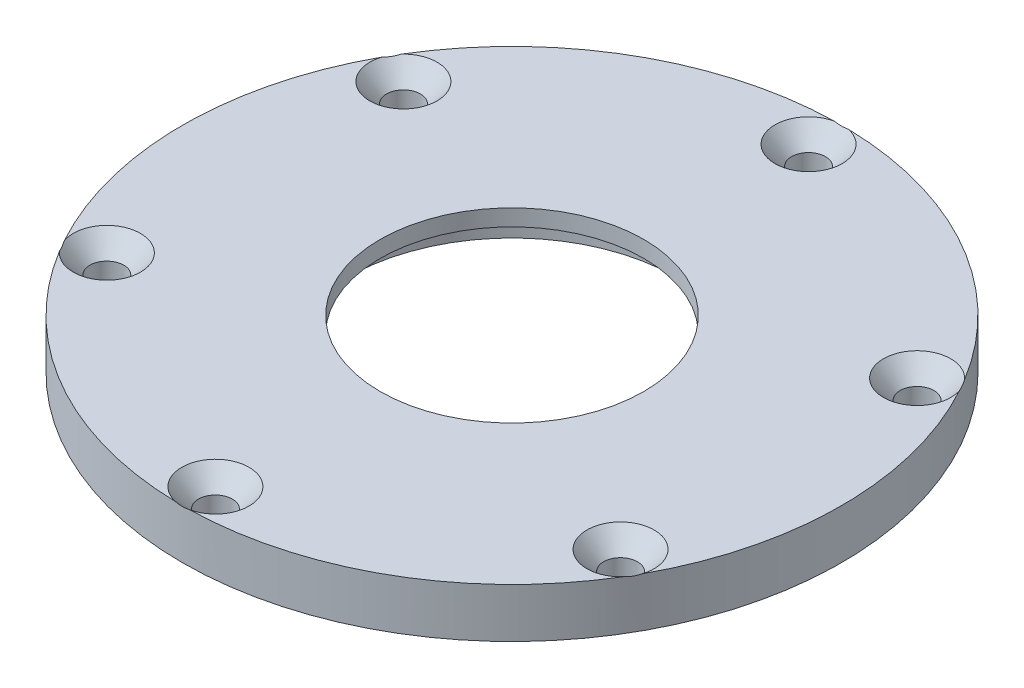
from build123d import *

# Parameters (mm, degrees)
SKETCH1_R                                         = 31.75
BOSS_EXTRUDE1_DEPTH                               = 4.7625
CSK_FOR_4_FLAT_HEAD_SOCKET_CAP_SCREW1_D           = 3.2639
CSK_FOR_4_FLAT_HEAD_SOCKET_CAP_SCREW1_CSINK_D     = 6.477
CSK_FOR_4_FLAT_HEAD_SOCKET_CAP_SCREW1_CSINK_ANGLE = 82
SKETCH6_R                                         = 15.875
CUT_EXTRUDE1_DEPTH                                = 3.175
SKETCH7_R                                         = 12.7
CUT_EXTRUDE2_DEPTH                                = 3.175
SKETCH8_R                                         = 17.4625
CUT_EXTRUDE3_DEPTH                                = 3.175


with BuildPart() as part:
    # Sketch1 → Boss-Extrude1 (new body)
    with BuildSketch(Plane(origin=(0, 0, 0), x_dir=(1, 0, 0), z_dir=(0, 1, 0))):
        with Locations(Location((0, 0, 0), (0, 0, 90))):
            Circle(SKETCH1_R)
    extrude(amount=BOSS_EXTRUDE1_DEPTH)

    # CSK for #4 Flat Head Socket Cap Screw1 (through all)
    with Locations(Plane(origin=(0, 4.7625, 0), x_dir=(-1, 0, 0), z_dir=(0, 1, 0))):
        with Locations((0, 28.575), (24.746675913, 14.2875), (24.746675913, -14.2875), (0, -28.575), (-24.746675913, -14.2875), (-24.746675913, 14.2875)):
            CounterSinkHole(CSK_FOR_4_FLAT_HEAD_SOCKET_CAP_SCREW1_D / 2, CSK_FOR_4_FLAT_HEAD_SOCKET_CAP_SCREW1_CSINK_D / 2, counter_sink_angle=CSK_FOR_4_FLAT_HEAD_SOCKET_CAP_SCREW1_CSINK_ANGLE)

    # Sketch6 → Cut-Extrude1 (cut)
    with BuildSketch(Plane.XZ):
        with Locations(Location((0, 0, 0), (0, 0, 270))):
            Circle(SKETCH6_R)
    extrude(amount=-CUT_EXTRUDE1_DEPTH, mode=Mode.SUBTRACT)

    # Sketch7 → Cut-Extrude2 (cut)
    with BuildSketch(Plane.XZ.offset(-3.175)):
        with Locations(Location((0, 0, 0), (0, 0, 270))):
            Circle(SKETCH7_R)
    extrude(amount=-CUT_EXTRUDE2_DEPTH, mode=Mode.SUBTRACT)

    # Sketch8 → Cut-Extrude3 (cut)
    with BuildSketch(Plane.XZ):
        with BuildLine():
            ThreePointArc((26.134754006, 11.432002809), (27.408069158, 11.477856343), (28.298548725, 10.5665495))
            ThreePointArc((28.298548725, 10.5665495), (30.20695, 0), (28.298548725, -10.5665495))
            ThreePointArc((28.298548725, -10.5665495), (27.408069158, -11.477856343), (26.134754006, -11.432002809))
            ThreePointArc((26.134754006, -11.432002809), (21.997045256, -12.7), (22.967781852, -16.917359487))
            ThreePointArc((22.967781852, -16.917359487), (23.644149753, -17.997155988), (23.30017466, -19.223987337))
            ThreePointArc((23.30017466, -19.223987337), (15.103475, -26.159986071), (4.998374065, -29.790536836))
            ThreePointArc((4.998374065, -29.790536836), (3.763919405, -29.475012331), (3.166972154, -28.349362296))
            ThreePointArc((3.166972154, -28.349362296), (0, -25.4), (-3.166972154, -28.349362296))
            ThreePointArc((-3.166972154, -28.349362296), (-3.763919405, -29.475012331), (-4.998374065, -29.790536836))
            ThreePointArc((-4.998374065, -29.790536836), (-15.103475, -26.159986071), (-23.30017466, -19.223987337))
            ThreePointArc((-23.30017466, -19.223987337), (-23.644149753, -17.997155988), (-22.967781852, -16.917359487))
            ThreePointArc((-22.967781852, -16.917359487), (-21.997045256, -12.7), (-26.134754006, -11.432002809))
            ThreePointArc((-26.134754006, -11.432002809), (-27.408069158, -11.477856343), (-28.298548725, -10.5665495))
            ThreePointArc((-28.298548725, -10.5665495), (-30.20695, 0), (-28.298548725, 10.5665495))
            ThreePointArc((-28.298548725, 10.5665495), (-27.408069158, 11.477856343), (-26.134754006, 11.432002809))
            ThreePointArc((-26.134754006, 11.432002809), (-21.997045256, 12.7), (-22.967781852, 16.917359487))
            ThreePointArc((-22.967781852, 16.917359487), (-23.644149753, 17.997155988), (-23.30017466, 19.223987337))
            ThreePointArc((-23.30017466, 19.223987337), (-15.103475, 26.159986071), (-4.998374065, 29.790536836))
            ThreePointArc((-4.998374065, 29.790536836), (-3.763919405, 29.475012331), (-3.166972154, 28.349362296))
            ThreePointArc((-3.166972154, 28.349362296), (0, 25.4), (3.166972154, 28.349362296))
            ThreePointArc((3.166972154, 28.349362296), (3.763919405, 29.475012331), (4.998374065, 29.790536836))
            ThreePointArc((4.998374065, 29.790536836), (15.103475, 26.159986071), (23.30017466, 19.223987337))
            ThreePointArc((23.30017466, 19.223987337), (23.644149753, 17.997155988), (22.967781852, 16.917359487))
            ThreePointArc((22.967781852, 16.917359487), (21.997045256, 12.7), (26.134754006, 11.432002809))
        make_face()
        with Locations(Location((0, 0, 0), (0, 0, 270))):
            Circle(SKETCH8_R, mode=Mode.SUBTRACT)
    extrude(amount=-CUT_EXTRUDE3_DEPTH, mode=Mode.SUBTRACT)


solid = part.part
